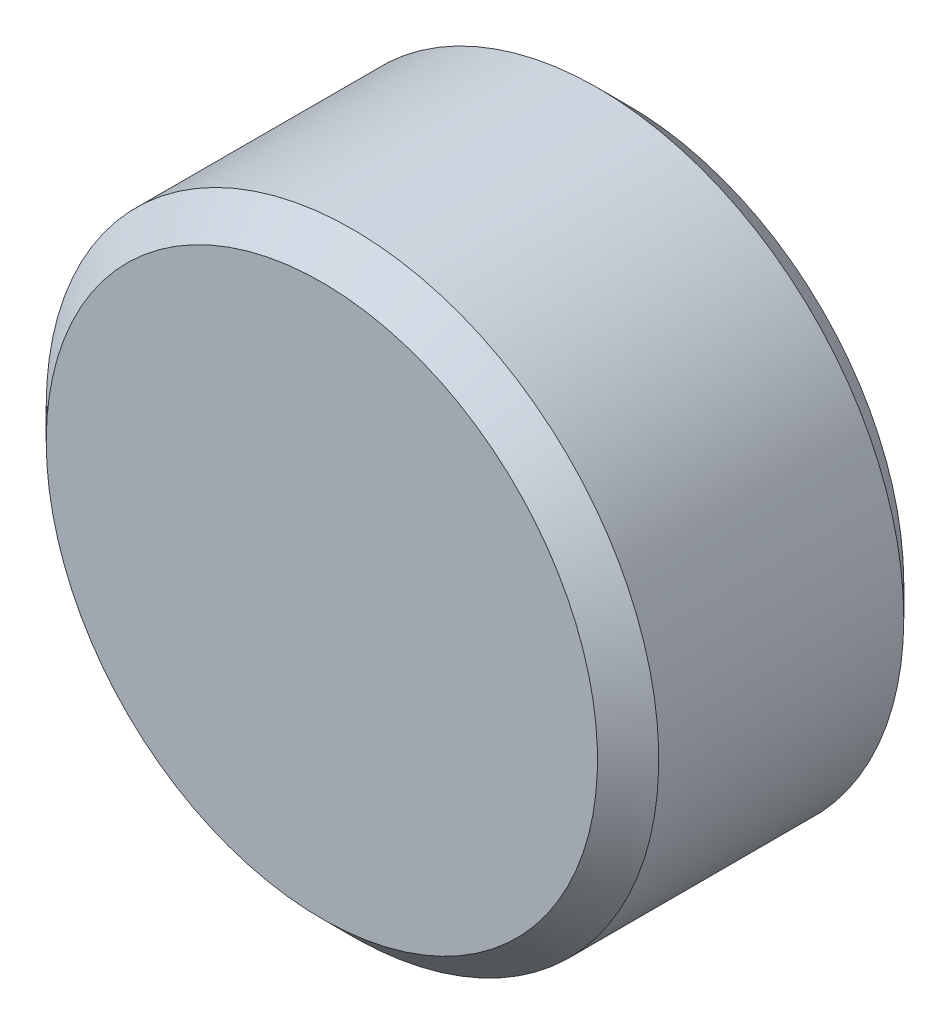
from build123d import *

# Parameters (mm, degrees)
SKETCH_1_R      = 3
EXTRUDE_1_DEPTH = 3
CHAMFER_1_SIZE  = 0.3


with BuildPart() as part:
    # Эскиз1 → Бобышка-Вытянуть1 (new body)
    with BuildSketch(Plane.XY):
        Circle(SKETCH_1_R)
    extrude(amount=EXTRUDE_1_DEPTH)

    # Фаска1
    chamfer_1_edges = [part.edges().sort_by_distance(p)[0] for p in [
        (-3, 0, 0),
        (-3, 0, 3),
    ]]
    chamfer(chamfer_1_edges, length=CHAMFER_1_SIZE)


solid = part.part
